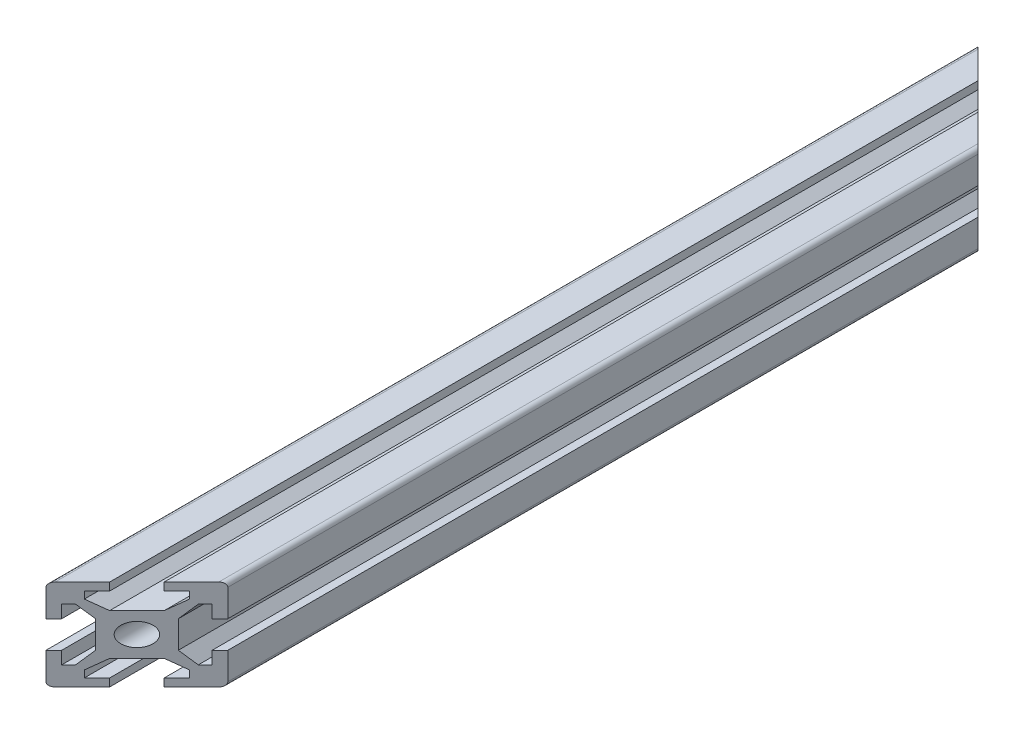
from build123d import *

# Parameters (mm, degrees)
BOSS_EXTRUDE1_DEPTH     = 102.5
CUT_EXTRUDE1_DEPTH      = 206.48722588
CUT_EXTRUDE1_DEPTH_BACK = 206.48722588
SKETCH2_R               = 2.5
FILLET1_R               = 1
SKETCH3_W               = 42.278906
SKETCH3_H               = 22
CUT_EXTRUDE2_DEPTH      = 160.3443598
SKETCH4_W               = 35
SKETCH4_H               = 22.104489803
CUT_EXTRUDE3_DEPTH      = 160.3443598


with BuildPart() as part:
    # Sketch1 → Boss-Extrude1 (new, symmetric)
    with BuildSketch(Plane.XY):
        Polygon((-10, 10), (-3, 10), (-3, 8.272610059), (-5.783778863, 8.272610059), (-5.783778863, 6.747994248), (-3, 4.550753814), (3, 4.550753814), (5.783778863, 6.747994248), (5.783778863, 8.272610059), (3, 8.272610059), (3, 10), (10, 10), (10, 3), (8.272610059, 3), (8.272610059, 5.783778863), (6.747994248, 5.783778863), (4.55, 3.000595152), (4.55, -2.999404848), (6.747994248, -5.783778863), (8.272610059, -5.783778863), (8.272610059, -3), (10, -3), (10, -10), (3, -10), (3, -8.272610059), (5.783778863, -8.272610059), (5.783778863, -6.747994248), (2.999404848, -4.55), (-3.000595152, -4.55), (-5.783778863, -6.747994248), (-5.783778863, -8.272610059), (-3, -8.272610059), (-3, -10), (-10, -10), (-10, -3), (-8.272610059, -3), (-8.272610059, -5.783778863), (-6.747994248, -5.783778863), (-4.55, -3.000595152), (-4.55, 2.999404848), (-6.747994248, 5.783778863), (-8.272610059, 5.783778863), (-8.272610059, 3), (-10, 3), align=None)
    extrude(amount=BOSS_EXTRUDE1_DEPTH, both=True)

    # Sketch2 → Cut-Extrude1 (cut, two sides: drawn at the far end of the back side and taken through both)
    with BuildSketch(Plane.XY.offset(102.5).offset(-CUT_EXTRUDE1_DEPTH_BACK)):
        Circle(SKETCH2_R)
    extrude(amount=CUT_EXTRUDE1_DEPTH + CUT_EXTRUDE1_DEPTH_BACK, mode=Mode.SUBTRACT)

    # Fillet1
    fillet1_edges = [part.edges().sort_by_distance(p)[0] for p in [
        (-10, -10, 0),
        (10, -10, 0),
        (10, 10, 0),
        (-10, 10, 0),
    ]]
    fillet(fillet1_edges, radius=FILLET1_R)

    # Sketch3 → Cut-Extrude2 (cut, through all)
    with BuildSketch(Plane(origin=(46.25, 0, -46.25), x_dir=(0.7071067811865477, 0, 0.7071067811865475), z_dir=(-0.7071067811865475, 0, 0.7071067811865477))):
        with Locations((-63.573496093, 0.067646977)):
            Rectangle(SKETCH3_W, SKETCH3_H)
    extrude(amount=-CUT_EXTRUDE2_DEPTH, mode=Mode.SUBTRACT)

    # Sketch4 → Cut-Extrude3 (cut, through all)
    with BuildSketch(Plane(origin=(46.25, 0, 46.25), x_dir=(-0.7071067811865477, 0, 0.7071067811865475), z_dir=(-0.7071067811865475, 0, -0.7071067811865477))):
        with Locations((66.938622458, 0.016996688)):
            Rectangle(SKETCH4_W, SKETCH4_H)
    extrude(amount=-CUT_EXTRUDE3_DEPTH, mode=Mode.SUBTRACT)


solid = part.part
